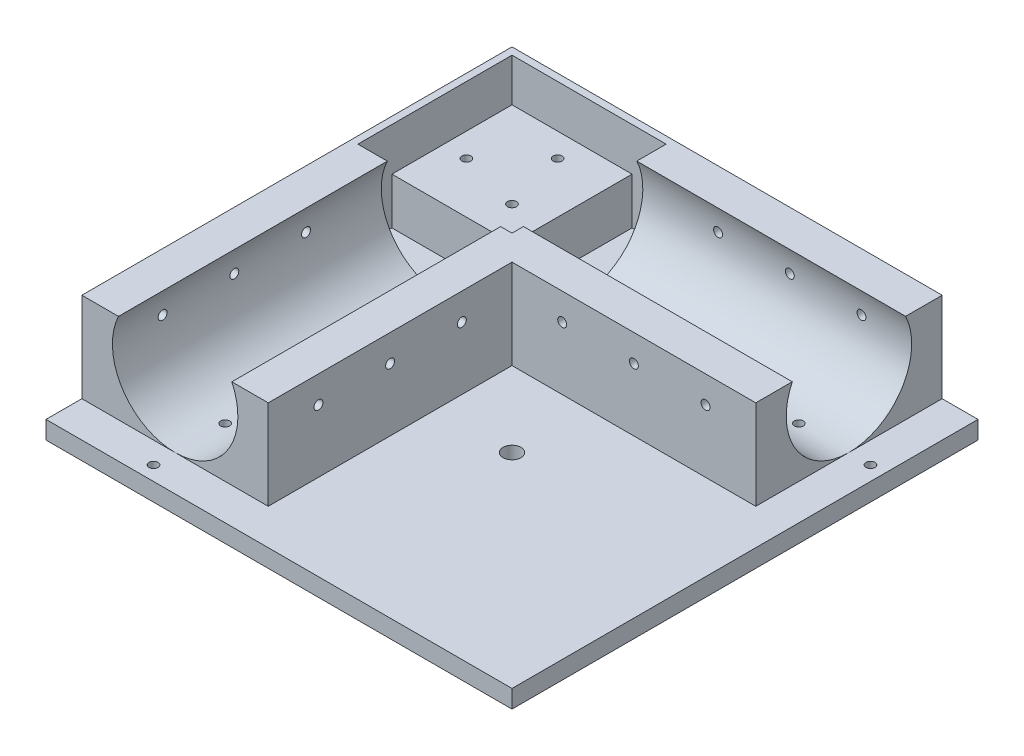
from build123d import *

# Parameters (mm, degrees)
SKETCH_1_W             = 130
SKETCH_1_H             = 130
EXTRUDE_1251_DEPTH     = 5
EXTRUDE_1478_DEPTH     = 25
SKETCH_3_R             = 17.5
CUT_EXTRUDE_1_DEPTH    = 85
SKETCH_4_R             = 17.5
CUT_EXTRUDE_2_DEPTH    = 85
SKETCH_8_W             = 52
SKETCH_8_H             = 25
CUT_EXTRUDE_1_2_DEPTH  = 10
SKETCH_9_W             = 52
SKETCH_9_H             = 25
CUT_EXTRUDE_2_2_DEPTH  = 10
SKETCH_5_W             = 2
SKETCH_5_H             = 2
SKETCH_5_H_2           = 43
SKETCH_5_W_2           = 43
EXTRUDE_2758_DEPTH     = 25
SKETCH_7_W             = 33.5
SKETCH_7_H             = 33.5
EXTRUDE_2892_DEPTH     = 13
HOLE_WIZARD_2949_D     = 5
HOLE_WIZARD_2949_DEPTH = 5
HOLE_WIZARD_2949_TIP   = 1.502151548
HOLE_WIZARD_1_D        = 2.5
HOLE_WIZARD_2_D        = 2.5
HOLE_WIZARD_6774_D     = 2.5
HOLE_WIZARD_1_2_D      = 2.5
HOLE_WIZARD_2_2_D      = 2.5


with BuildPart() as part:
    # 草图1 → Extrude 1251 (new body)
    with BuildSketch(Plane(origin=(0, 0, 0), x_dir=(1, 0, 0), z_dir=(0, 1, 0))):
        with Locations((65, 65)):
            Rectangle(SKETCH_1_W, SKETCH_1_H)
    extrude(amount=EXTRUDE_1251_DEPTH)

    # 草图2 → Extrude 1478 (add)
    with BuildSketch(Plane(origin=(0, 5, 0), x_dir=(1, 0, 0), z_dir=(0, 1, 0))):
        Polygon((0, 85), (0, 0), (52, 0), (52, 78), (130, 78), (130, 130), (45, 130), (45, 85), align=None)
    extrude(amount=EXTRUDE_1478_DEPTH)

    # 草图3 → Cut-Extrude 1 (cut)
    with BuildSketch(Plane.XY):
        with Locations((26.027680942, 22.5)):
            Circle(SKETCH_3_R)
    extrude(amount=-CUT_EXTRUDE_1_DEPTH, mode=Mode.SUBTRACT)

    # 草图4 → Cut-Extrude 2 (cut)
    with BuildSketch(Plane(origin=(130, 0, 0), x_dir=(0, 0, -1), z_dir=(1, 0, 0))):
        with Locations((104, 22.5)):
            Circle(SKETCH_4_R)
    extrude(amount=-CUT_EXTRUDE_2_DEPTH, mode=Mode.SUBTRACT)

    # 草图8 → Cut-Extrude 1 2 (cut)
    with BuildSketch(Plane(origin=(130, 0, 0), x_dir=(0, 0, -1), z_dir=(1, 0, 0))):
        with Locations((104, 17.5)):
            Rectangle(SKETCH_8_W, SKETCH_8_H)
    extrude(amount=-CUT_EXTRUDE_1_2_DEPTH, mode=Mode.SUBTRACT)

    # 草图9 → Cut-Extrude 2 2 (cut)
    with BuildSketch(Plane.XY):
        with Locations((26, 17.5)):
            Rectangle(SKETCH_9_W, SKETCH_9_H)
    extrude(amount=-CUT_EXTRUDE_2_2_DEPTH, mode=Mode.SUBTRACT)

    # 草图5 → Extrude 2758 (add)
    with BuildSketch(Plane(origin=(0, 5, 0), x_dir=(1, 0, 0), z_dir=(0, 1, 0))):
        with Locations((1, 129)):
            Rectangle(SKETCH_5_W, SKETCH_5_H)
        with Locations((1, 106.5)):
            Rectangle(SKETCH_5_W, SKETCH_5_H_2)
        with Locations((23.5, 129)):
            Rectangle(SKETCH_5_W_2, SKETCH_5_H)
    extrude(amount=EXTRUDE_2758_DEPTH)

    # 草图7 → Extrude 2892 (add)
    with BuildSketch(Plane(origin=(0, 5, 0), x_dir=(1, 0, 0), z_dir=(0, 1, 0))):
        with Locations((18.75, 111.25)):
            Rectangle(SKETCH_7_W, SKETCH_7_H)
    extrude(amount=EXTRUDE_2892_DEPTH)

    # Hole Wizard 2949
    with Locations(Plane(origin=(48, 0, -82), x_dir=(0, 0, -1), z_dir=(0, -1, 0))):
        with Locations((0, 0), (-25, 25)):
            Hole(HOLE_WIZARD_2949_D / 2, depth=HOLE_WIZARD_2949_DEPTH)
            with Locations((0, 0, -(HOLE_WIZARD_2949_DEPTH + HOLE_WIZARD_2949_TIP / 2))):  # 118° drill point
                Cone(0, HOLE_WIZARD_2949_D / 2, HOLE_WIZARD_2949_TIP, mode=Mode.SUBTRACT)

    # Hole Wizard 1 (through all)
    with Locations(Plane(origin=(0, 0, 0), x_dir=(-1, 0, 0), z_dir=(0, -1, 0))):
        with Locations((-26, 64), (-26, 79), (-26, 44), (-26, 24), (-26, 4)):
            Hole(HOLE_WIZARD_1_D / 2)

    # Hole Wizard 2 (through all)
    with Locations(Plane(origin=(0, 0, 0), x_dir=(-1, 0, 0), z_dir=(0, -1, 0))):
        with Locations((-66, 104), (-51, 104), (-86, 104), (-106, 104), (-126, 104)):
            Hole(HOLE_WIZARD_2_D / 2)

    # Hole Wizard 6774 (through all)
    with Locations(Plane(origin=(0, 18, 0), x_dir=(1, 0, 0), z_dir=(0, 1, 0))):
        with Locations((21.341257188, 121.386664873), (8.613335127, 108.658742812), (26, 104)):
            Hole(HOLE_WIZARD_6774_D / 2)

    # Hole Wizard 1 2 (through all)
    with Locations(Plane(origin=(52, 0, 0), x_dir=(0, 0, -1), z_dir=(1, 0, 0))):
        with Locations((44, 22.5), (24, 22.5), (64, 22.5)):
            Hole(HOLE_WIZARD_1_2_D / 2)

    # Hole Wizard 2 2 (through all)
    with Locations(Plane.XY.offset(-78)):
        with Locations((86, 22.5), (106, 22.5), (66, 22.5)):
            Hole(HOLE_WIZARD_2_2_D / 2)


solid = part.part
